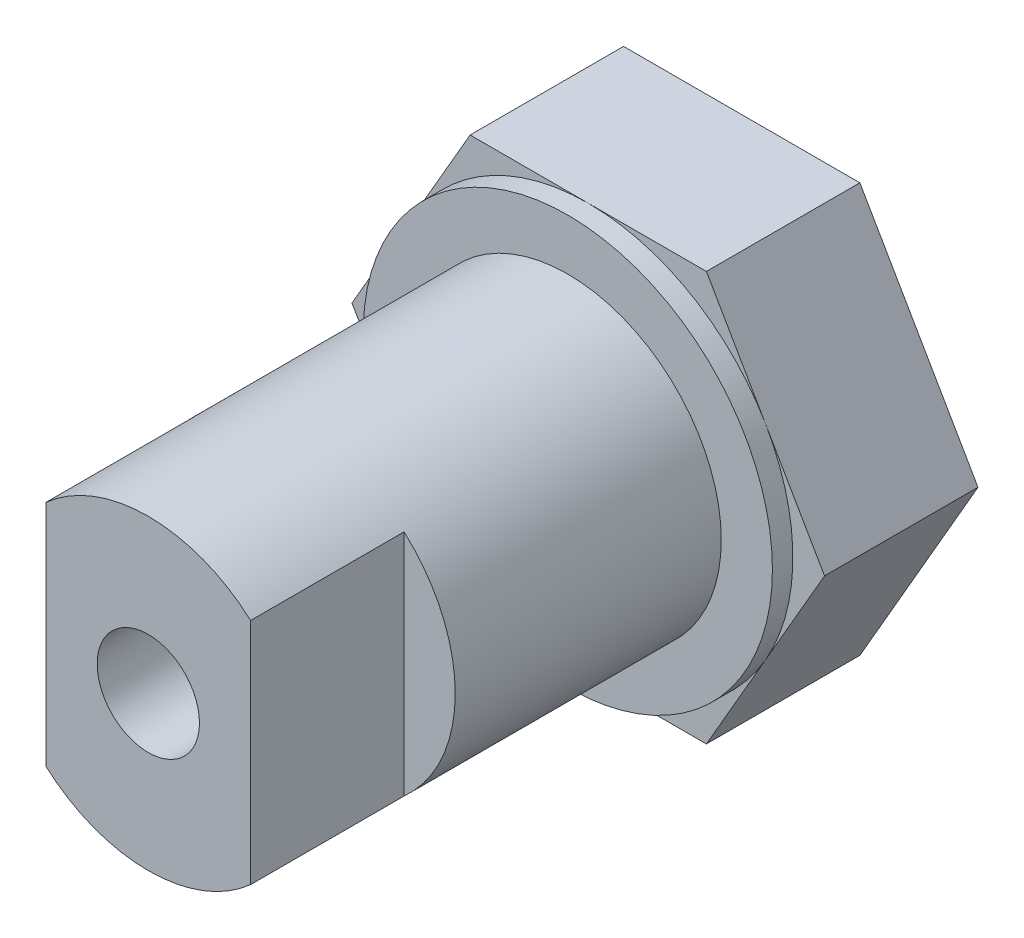
from build123d import *

# Parameters (mm, degrees)
BOSS_EXTRUDE5_DEPTH = 15
SKETCH4_R           = 20
BOSS_EXTRUDE6_DEPTH = 2
SKETCH5_R           = 15
BOSS_EXTRUDE7_DEPTH = 41
SKETCH6_R           = 5
CUT_EXTRUDE2_DEPTH  = 100
CUT_EXTRUDE3_START  = -15
CUT_EXTRUDE3_DEPTH  = 15


with BuildPart() as part:
    # Sketch1 → Boss-Extrude5 (new body)
    with BuildSketch(Plane.XY):
        Polygon((23.094010768, 0), (11.547005384, 20), (-11.547005384, 20), (-23.094010768, 0), (-11.547005384, -20), (11.547005384, -20), align=None)
    extrude(amount=BOSS_EXTRUDE5_DEPTH)

    # Sketch4 → Boss-Extrude6 (add)
    with BuildSketch(Plane.XY.offset(15)):
        with Locations(Location((0, 0, 0), (0, 0, 150))):
            Circle(SKETCH4_R)
    extrude(amount=BOSS_EXTRUDE6_DEPTH)

    # Sketch5 → Boss-Extrude7 (add)
    with BuildSketch(Plane.XY.offset(17)):
        Circle(SKETCH5_R)
    extrude(amount=BOSS_EXTRUDE7_DEPTH)

    # Sketch6 → Cut-Extrude2 (cut)
    with BuildSketch(Plane.XY.offset(58)):
        Circle(SKETCH6_R)
    extrude(amount=-CUT_EXTRUDE2_DEPTH, mode=Mode.SUBTRACT)

    # Sketch9 → Cut-Extrude3 (cut)
    with BuildSketch(Plane.XY.offset(58).offset(CUT_EXTRUDE3_START)):
        with BuildLine():
            Line((-10, -11.180339887), (-10, 0))
            Line((-10, 0), (-10, 11.180339887))
            ThreePointArc((-10, 11.180339887), (-15, 0), (-10, -11.180339887))
        make_face()
        with BuildLine():
            Line((10, 11.180339887), (10, 0))
            Line((10, 0), (10, -11.180339887))
            ThreePointArc((10, -11.180339887), (13.693063938, -6.123724357), (15, 0))
            ThreePointArc((15, 0), (13.693063938, 6.123724357), (10, 11.180339887))
        make_face()
    extrude(amount=CUT_EXTRUDE3_DEPTH, mode=Mode.SUBTRACT)


solid = part.part
